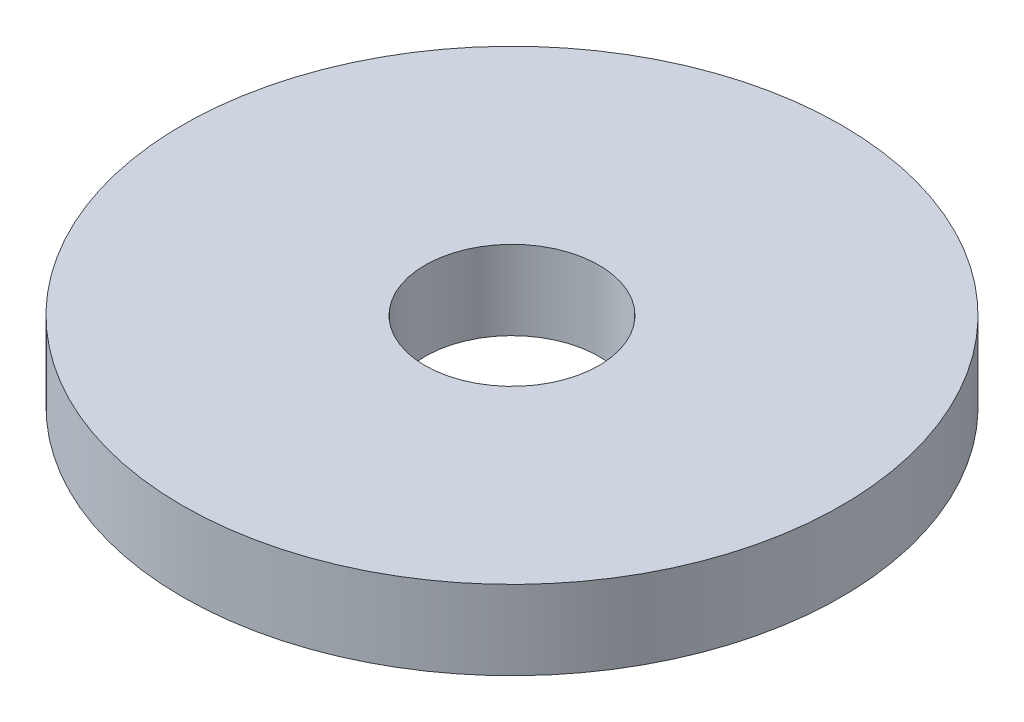
from build123d import *

# Parameters (mm, degrees)
ESBO_O1_R                = 12.5
RESSALTO_EXTRUS_O1_DEPTH = 3
FURO_COM_FOLGA_DE_M61_D  = 6.6


with BuildPart() as part:
    # Esboço1 → Ressalto-extrusão1 (new body)
    with BuildSketch(Plane(origin=(0, 0, 0), x_dir=(1, 0, 0), z_dir=(0, 1, 0))):
        with Locations(Location((0, 0, 0), (0, 0, 270))):
            Circle(ESBO_O1_R)
    extrude(amount=RESSALTO_EXTRUS_O1_DEPTH)

    # Furo com folga de M61 (through all)
    with Locations(Plane(origin=(0, 3, 0), x_dir=(1, 0, 0), z_dir=(0, 1, 0))):
        with Locations((0, 0)):
            Hole(FURO_COM_FOLGA_DE_M61_D / 2)


solid = part.part
